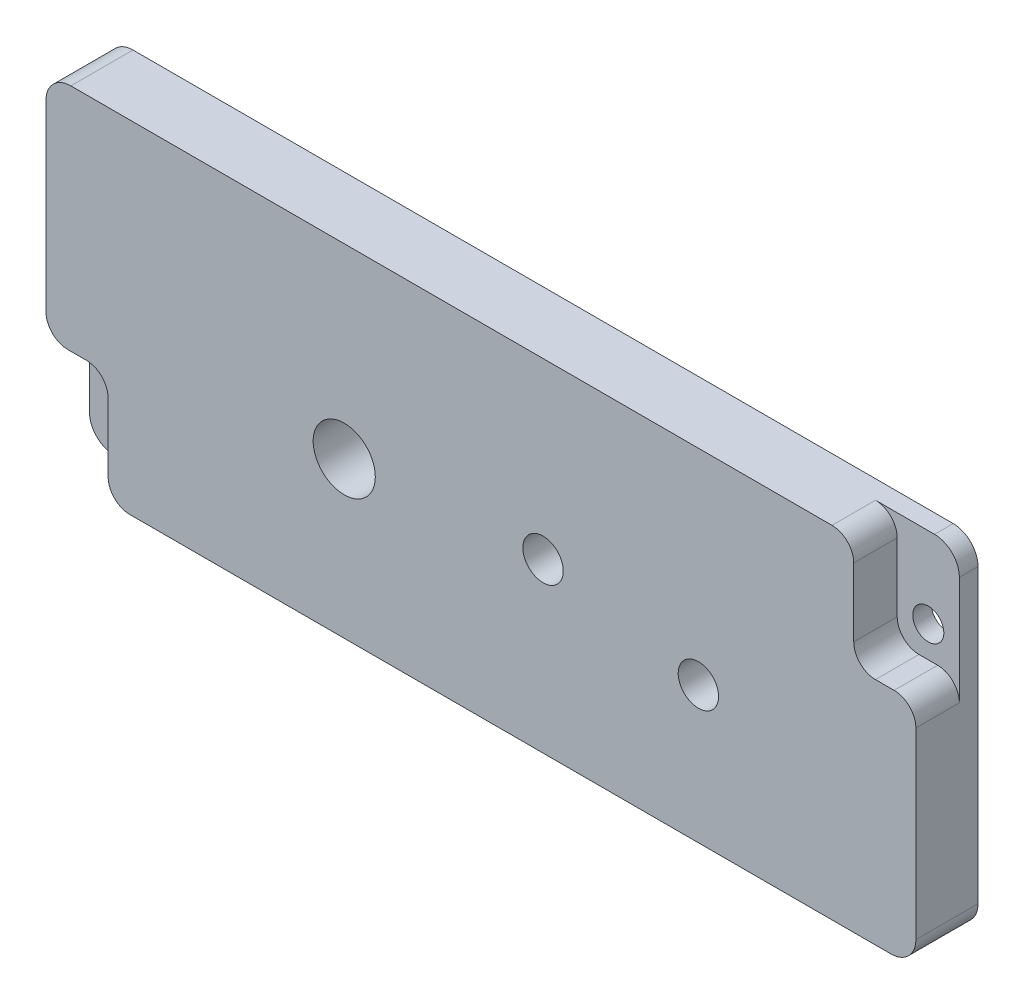
from build123d import *

# Parameters (mm, degrees)
SKETCH1_R           = 5
SKETCH1_R_2         = 3.25
BOSS_EXTRUDE1_DEPTH = 10
CUT_EXTRUDE1_DEPTH  = 7
SKETCH3_R           = 2.5
CUT_EXTRUDE2_DEPTH  = 10
FILLET1_R           = 3.5


with BuildPart() as part:
    # Sketch1 → Boss-Extrude1 (new body)
    with BuildSketch(Plane.XY):
        with BuildLine():
            Line((-73.747603834, 33.92172524), (58.252396166, 33.92172524))
            ThreePointArc((58.252396166, 33.92172524), (61.080823291, 32.750152364), (62.252396166, 29.92172524))
            Line((62.252396166, 29.92172524), (62.252396166, -17.07827476))
            ThreePointArc((62.252396166, -17.07827476), (61.080823291, -19.906701885), (58.252396166, -21.07827476))
            Line((58.252396166, -21.07827476), (-73.747603834, -21.07827476))
            ThreePointArc((-73.747603834, -21.07827476), (-76.576030959, -19.906701885), (-77.747603834, -17.07827476))
            Line((-77.747603834, -17.07827476), (-77.747603834, 29.92172524))
            ThreePointArc((-77.747603834, 29.92172524), (-76.576030959, 32.750152364), (-73.747603834, 33.92172524))
        make_face()
        with Locations((-29.747603834, 3.92172524)):
            Circle(SKETCH1_R, mode=Mode.SUBTRACT)
        with Locations((2.252396166, 5.92172524)):
            Circle(SKETCH1_R_2, mode=Mode.SUBTRACT)
        with Locations((27.252396166, 0.92172524)):
            Circle(SKETCH1_R_2, mode=Mode.SUBTRACT)
    extrude(amount=BOSS_EXTRUDE1_DEPTH)

    # Sketch2 → Cut-Extrude1 (cut)
    with BuildSketch(Plane.XY.offset(10)):
        with BuildLine():
            Line((-77.747603834, -3.07827476), (-71.247603834, -3.07827476))
            ThreePointArc((-71.247603834, -3.07827476), (-68.7727301, -4.103401026), (-67.747603834, -6.57827476))
            Line((-67.747603834, -6.57827476), (-67.747603834, -21.07827476))
            Line((-67.747603834, -21.07827476), (-77.747603834, -21.07827476))
            Line((-77.747603834, -21.07827476), (-77.747603834, -3.07827476))
        make_face()
        with BuildLine():
            Line((62.252396166, 15.92172524), (55.752396166, 15.92172524))
            ThreePointArc((55.752396166, 15.92172524), (53.277522432, 16.946851505), (52.252396166, 19.42172524))
            Line((52.252396166, 19.42172524), (52.252396166, 33.92172524))
            Line((52.252396166, 33.92172524), (62.252396166, 33.92172524))
            Line((62.252396166, 33.92172524), (62.252396166, 15.92172524))
        make_face()
    extrude(amount=-CUT_EXTRUDE1_DEPTH, mode=Mode.SUBTRACT)

    # Sketch3 → Cut-Extrude2 (cut)
    with BuildSketch(Plane.XY.offset(3)):
        with Locations((-72.747603834, -8.07827476)):
            Circle(SKETCH3_R)
        with Locations((57.252396166, 20.92172524)):
            Circle(SKETCH3_R)
    extrude(amount=-CUT_EXTRUDE2_DEPTH, mode=Mode.SUBTRACT)

    # Fillet1
    fillet1_edges = [part.edges().sort_by_distance(p)[0] for p in [
        (-67.747603834, -21.07827476, 6.5),
        (-77.747603834, -3.07827476, 6.5),
        (52.252396166, 33.92172524, 6.5),
        (62.252396166, 15.92172524, 6.5),
    ]]
    fillet(fillet1_edges, radius=FILLET1_R)


solid = part.part
